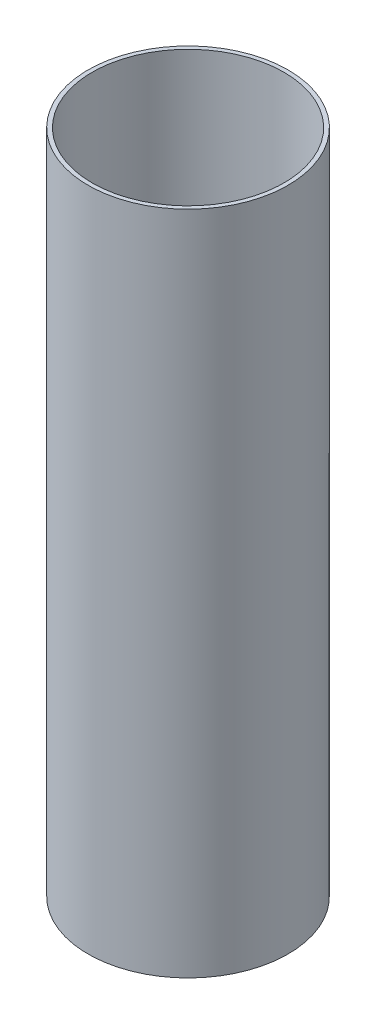
from build123d import *

# Parameters (mm, degrees)
SKETCH2_W = 1.143
SKETCH2_H = 187.325


with BuildPart() as part:
    # Sketch2 → Revolve1 (revolve)
    with BuildSketch(Plane.XY, mode=Mode.PRIVATE) as revolve1_sk:
        with Locations((27.559, -123.504100015)):
            Rectangle(SKETCH2_W, SKETCH2_H)
    revolve(revolve1_sk.sketch.rotate(Axis((0, 0, 0), (0, 1, 0)), 90), axis=Axis((0, 0, 0), (0, 1, 0)))


solid = part.part
